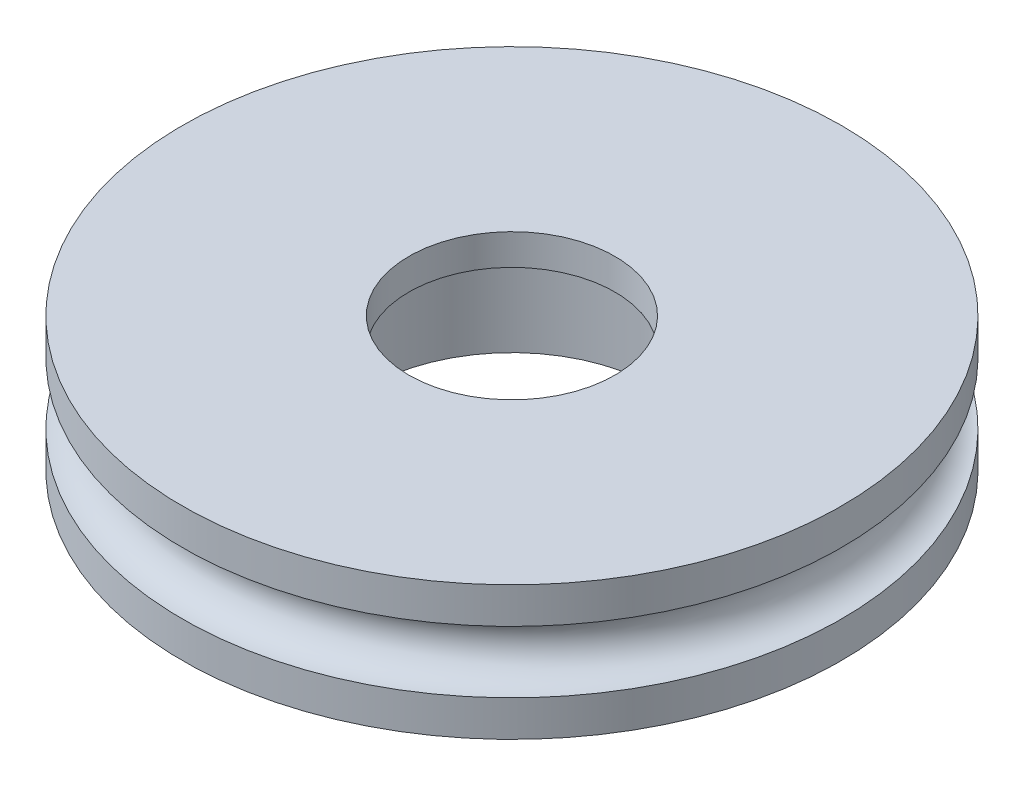
from build123d import *

# Parameters (mm, degrees)
SKETCH1_R           = 8
SKETCH1_R_2         = 3.5
BOSS_EXTRUDE1_DEPTH = 1.625
BOSS_EXTRUDE2_START = -0.75
SKETCH3_R           = 3.5
SKETCH3_R_2         = 2.5
BOSS_EXTRUDE2_DEPTH = 0.75


with BuildPart() as part:
    # Sketch1 → Boss-Extrude1 (new, symmetric)
    with BuildSketch(Plane(origin=(0, 0, 0), x_dir=(1, 0, 0), z_dir=(0, 1, 0))):
        with Locations(Location((0, 0, 0), (0, 0, 90))):
            Circle(SKETCH1_R)
        with Locations(Location((0, 0, 0), (0, 0, 90))):
            Circle(SKETCH1_R_2, mode=Mode.SUBTRACT)
    extrude(amount=BOSS_EXTRUDE1_DEPTH, both=True)

    # Sketch2 → Cut-Revolve1 (revolve, cut)
    with BuildSketch(Plane(origin=(0, 0, 0), x_dir=(0, 0, -1), z_dir=(1, 0, 0)), mode=Mode.PRIVATE) as cut_revolve1_sk:
        with BuildLine():
            Line((-8, 0.75), (-8, -0.75))
            ThreePointArc((-8, -0.75), (-7.25, 0), (-8, 0.75))
        make_face()
    revolve(cut_revolve1_sk.sketch.rotate(Axis((0, 1.625, 0), (0, -1, 0)), 180), axis=Axis((0, 1.625, 0), (0, -1, 0)), mode=Mode.SUBTRACT)

    # Sketch3 → Boss-Extrude2 (add)
    with BuildSketch(Plane(origin=(0, 1.625, 0), x_dir=(1, 0, 0), z_dir=(0, 1, 0)).offset(BOSS_EXTRUDE2_START)):
        with Locations(Location((0, 0, 0), (0, 0, 90))):
            Circle(SKETCH3_R)
        with Locations(Location((0, 0, 0), (0, 0, 270))):
            Circle(SKETCH3_R_2, mode=Mode.SUBTRACT)
    extrude(amount=BOSS_EXTRUDE2_DEPTH)


solid = part.part
